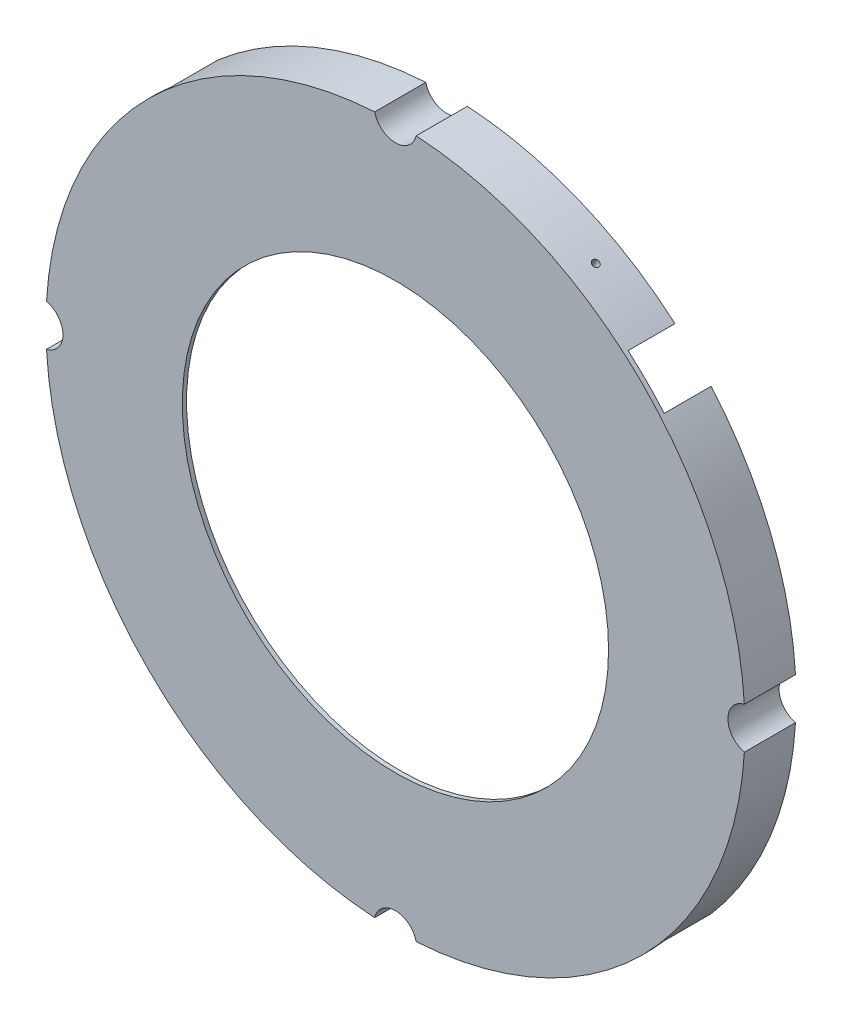
from build123d import *
from build123d.topology import SkipClean

# Parameters (mm, degrees)
SKETCH1_R                 = 82
SKETCH1_R_2               = 50
BOSS_EXTRUDE1_DEPTH       = 1
BOSS_EXTRUDE3_START       = 11
SKETCH3_R                 = 82
SKETCH3_R_2               = 75
BOSS_EXTRUDE3_DEPTH       = 11
SKETCH4_R                 = 5
CUT_EXTRUDE1_DEPTH        = 117.584733134
CIRPATTERN1_COUNT         = 4
CUT_EXTRUDE3_DEPTH        = 11
CIRPATTERN3_COUNT         = 4
M2X0_4_TAPPED_HOLE1_D     = 1.6
M2X0_4_TAPPED_HOLE1_DEPTH = 10
M2X0_4_TAPPED_HOLE1_TIP   = 0.480688495


with BuildPart() as part:
    # Sketch1 → Boss-Extrude1 (new body)
    with BuildSketch(Plane.XY):
        Circle(SKETCH1_R)
        Circle(SKETCH1_R_2, mode=Mode.SUBTRACT)
    extrude(amount=BOSS_EXTRUDE1_DEPTH)

    # Sketch3 → Boss-Extrude3 (add)
    with BuildSketch(Plane(origin=(0, 0, 0), x_dir=(-1, 0, 0), z_dir=(0, 0, -1)).offset(BOSS_EXTRUDE3_START)):
        Circle(SKETCH3_R)
        Circle(SKETCH3_R_2, mode=Mode.SUBTRACT)
    extrude(amount=-BOSS_EXTRUDE3_DEPTH)

    # Sketch4 → Cut-Extrude1 (cut, through all)
    with SkipClean():  # the faces are left unmerged after this step: merging them gives an invalid solid
        with BuildSketch(Plane.XY.offset(1)):
            with Locations((0, 83)):
                Circle(SKETCH4_R)
        cut_extrude1 = extrude(amount=-CUT_EXTRUDE1_DEPTH, mode=Mode.SUBTRACT)

    # CirPattern1: Cut-Extrude1 ×4 about axis
    cirpattern1_axis = Axis((0, 0, 0), (0, 0, 1))
    for i in range(1, CIRPATTERN1_COUNT):
        add(cut_extrude1.rotate(cirpattern1_axis, i * 360 / CIRPATTERN1_COUNT), mode=Mode.SUBTRACT)

    # Sketch6 → Cut-Extrude3 (cut)
    with BuildSketch(Plane(origin=(0, 0, -11), x_dir=(-1, 0, 0), z_dir=(0, 0, -1))):
        Polygon((38.066313572, 46.551594946), (59.467914625, 67.953195999), (67.882250994, 59.39696962), (46.551594946, 38.066313572), align=None)
    cut_extrude3 = extrude(amount=-CUT_EXTRUDE3_DEPTH, mode=Mode.SUBTRACT)

    # CirPattern3: Cut-Extrude3 ×4 about axis
    cirpattern3_axis = Axis((0, 0, 0), (0, 0, 1))
    for i in range(1, CIRPATTERN3_COUNT):
        add(cut_extrude3.rotate(cirpattern3_axis, i * 360 / CIRPATTERN3_COUNT), mode=Mode.SUBTRACT)

    # M2x0.4 Tapped Hole1
    with Locations(Plane(origin=(41.000000001, 71.01408311, -5), x_dir=(0.86602540378, -0.500000000007, 0), z_dir=(0.500000000007, 0.86602540378, 0))):
        with Locations((0, 0)):
            Hole(M2X0_4_TAPPED_HOLE1_D / 2, depth=M2X0_4_TAPPED_HOLE1_DEPTH)
            with Locations((0, 0, -(M2X0_4_TAPPED_HOLE1_DEPTH + M2X0_4_TAPPED_HOLE1_TIP / 2))):  # 118° drill point
                Cone(0, M2X0_4_TAPPED_HOLE1_D / 2, M2X0_4_TAPPED_HOLE1_TIP, mode=Mode.SUBTRACT)


solid = part.part
